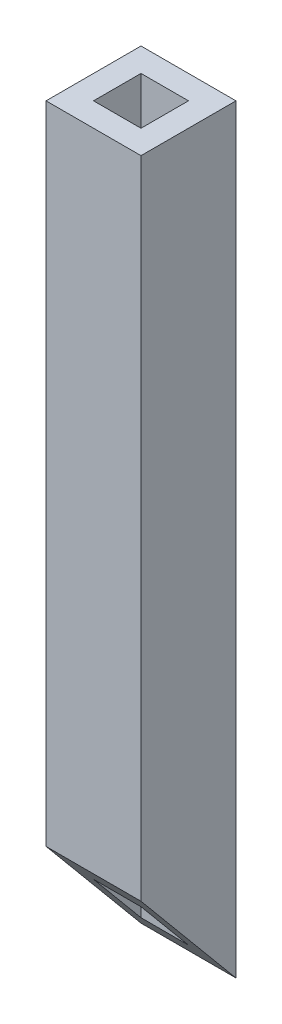
from build123d import *

# Parameters (mm, degrees)
SKETCH2_W           = 25.4
SKETCH2_H           = 203.2
BOSS_EXTRUDE2_DEPTH = 25.4
SKETCH3_W           = 12.7
SKETCH3_H           = 12.7
CUT_EXTRUDE1_DEPTH  = 207.350575478
CUT_EXTRUDE2_DEPTH  = 207.350575478


with BuildPart() as part:
    # Sketch2 → Boss-Extrude2 (new body)
    with BuildSketch(Plane.XY):
        with Locations((12.7, 101.6)):
            Rectangle(SKETCH2_W, SKETCH2_H)
    extrude(amount=BOSS_EXTRUDE2_DEPTH)

    # Sketch3 → Cut-Extrude1 (cut, through all)
    with BuildSketch(Plane.XZ):
        with Locations((12.7, 12.7)):
            Rectangle(SKETCH3_W, SKETCH3_H)
    extrude(amount=-CUT_EXTRUDE1_DEPTH, mode=Mode.SUBTRACT)

    # Sketch4 → Cut-Extrude2 (cut, through all)
    with BuildSketch(Plane(origin=(25.4, 0, 0), x_dir=(0, 0, -1), z_dir=(1, 0, 0))):
        Polygon((0, 0), (-25.4, 30.48), (-25.4, 0), align=None)
    extrude(amount=-CUT_EXTRUDE2_DEPTH, mode=Mode.SUBTRACT)


solid = part.part
